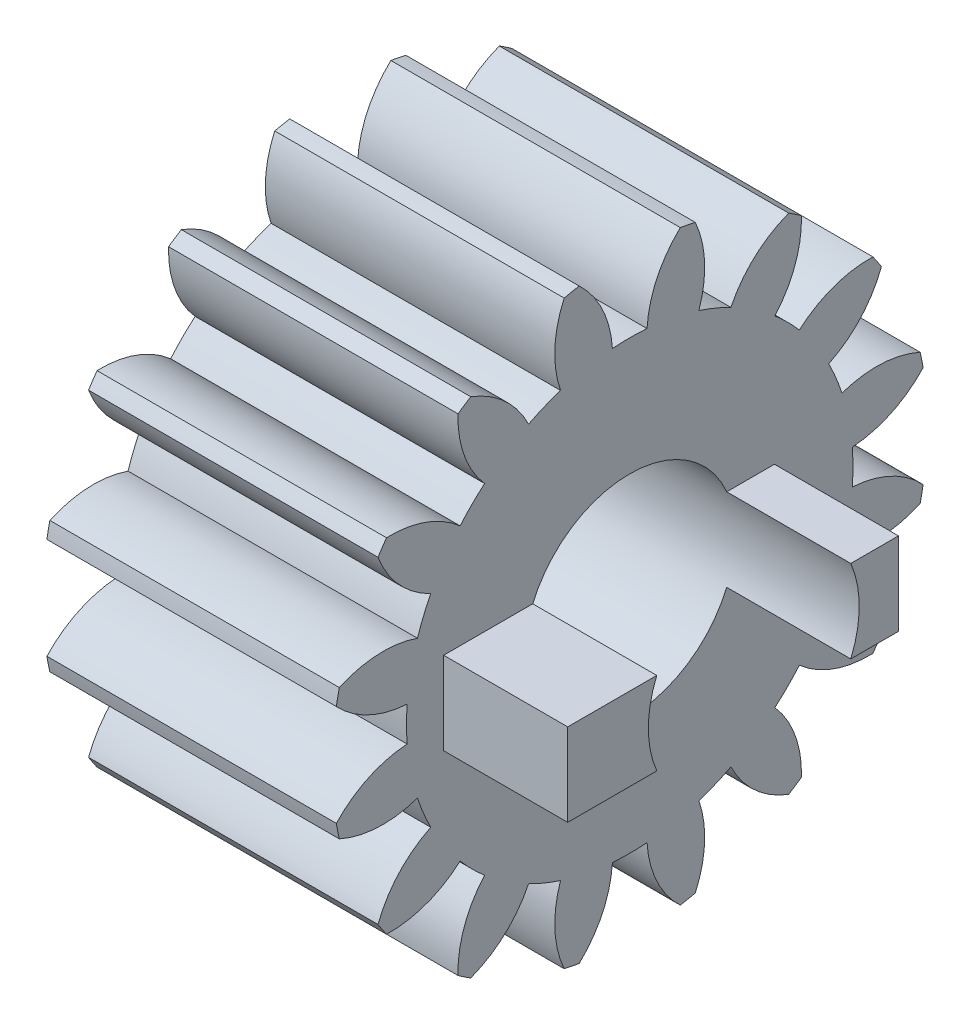
from build123d import *

# Parameters (mm, degrees)
BASPROSKE_W         = 7
BASPROSKE_H         = 7.2
TOOTHCUT_DEPTH      = 13.356374873
TEETHCUTS_COUNT     = 16
TEETHCUTS_ANGLE     = 337.5
BORSKE_R            = 0.5
BORE_DEPTH          = 50.0000508
SKETCH_1_R          = 2.55
CUT_EXTRUDE_1_DEPTH = 13.234691538
EXTRUDE_1_DEPTH     = 3


with BuildPart() as part:
    # BasProSke → Base-Revolve (revolve)
    with BuildSketch(Plane(origin=(0, 0, 0), x_dir=(1, 0, 0), z_dir=(0, 1, 0))):
        with Locations((3.5, 3.6)):
            Rectangle(BASPROSKE_W, BASPROSKE_H)
    revolve(axis=Axis((-10, 0, 0), (1, 0, 0)))

    # TooCutSke → ToothCut (cut, through all)
    with BuildSketch(Plane(origin=(0, 0, 0), x_dir=(0, 0, -1), z_dir=(1, 0, 0))):
        with BuildLine():
            ThreePointArc((0.418431057, 5.382761043), (0, 5.399), (-0.418431057, 5.382761043))
            ThreePointArc((-0.418431057, 5.382761043), (-0.663605074, 6.330572066), (-1.246629414, 7.117044349))
            ThreePointArc((-1.246629414, 7.117044349), (0, 7.2254), (1.246629414, 7.117044349))
            ThreePointArc((1.246629414, 7.117044349), (0.663605074, 6.330572066), (0.418431057, 5.382761043))
        make_face()
    toothcut = extrude(amount=TOOTHCUT_DEPTH, mode=Mode.SUBTRACT)

    # TeethCuts: ToothCut ×16 about axis
    teethcuts_axis = Axis((-10, 0, 0), (1, 0, 0))
    for i in range(1, TEETHCUTS_COUNT):
        add(toothcut.rotate(teethcuts_axis, i * TEETHCUTS_ANGLE / (TEETHCUTS_COUNT - 1)), mode=Mode.SUBTRACT)

    # BorSke → Bore (cut, symmetric)
    with BuildSketch(Plane(origin=(0, 0, 0), x_dir=(0, 0, -1), z_dir=(1, 0, 0))):
        Circle(BORSKE_R)
    extrude(amount=BORE_DEPTH, both=True, mode=Mode.SUBTRACT)

    # 草图1 → 切除-拉伸1 (cut, through all)
    with BuildSketch(Plane(origin=(0, 0, 0), x_dir=(0, 0, -1), z_dir=(1, 0, 0))):
        Circle(SKETCH_1_R)
    extrude(amount=CUT_EXTRUDE_1_DEPTH, mode=Mode.SUBTRACT)

    # 草图2 → 凸台-拉伸1 (add)
    with BuildSketch(Plane.ZY.offset(-7)):
        with BuildLine():
            Line((2.345740821, -1), (4.5, -1))
            Line((4.5, -1), (4.5, 1))
            Line((4.5, 1), (2.345740821, 1))
            ThreePointArc((2.345740821, 1), (2.55, 0), (2.345740821, -1))
        make_face()
        with BuildLine():
            Line((-3.5, -1), (-2.345740821, -1))
            ThreePointArc((-2.345740821, -1), (-2.55, 0), (-2.345740821, 1))
            Line((-2.345740821, 1), (-3.5, 1))
            Line((-3.5, 1), (-3.5, -1))
        make_face()
    extrude(amount=-EXTRUDE_1_DEPTH)


solid = part.part
